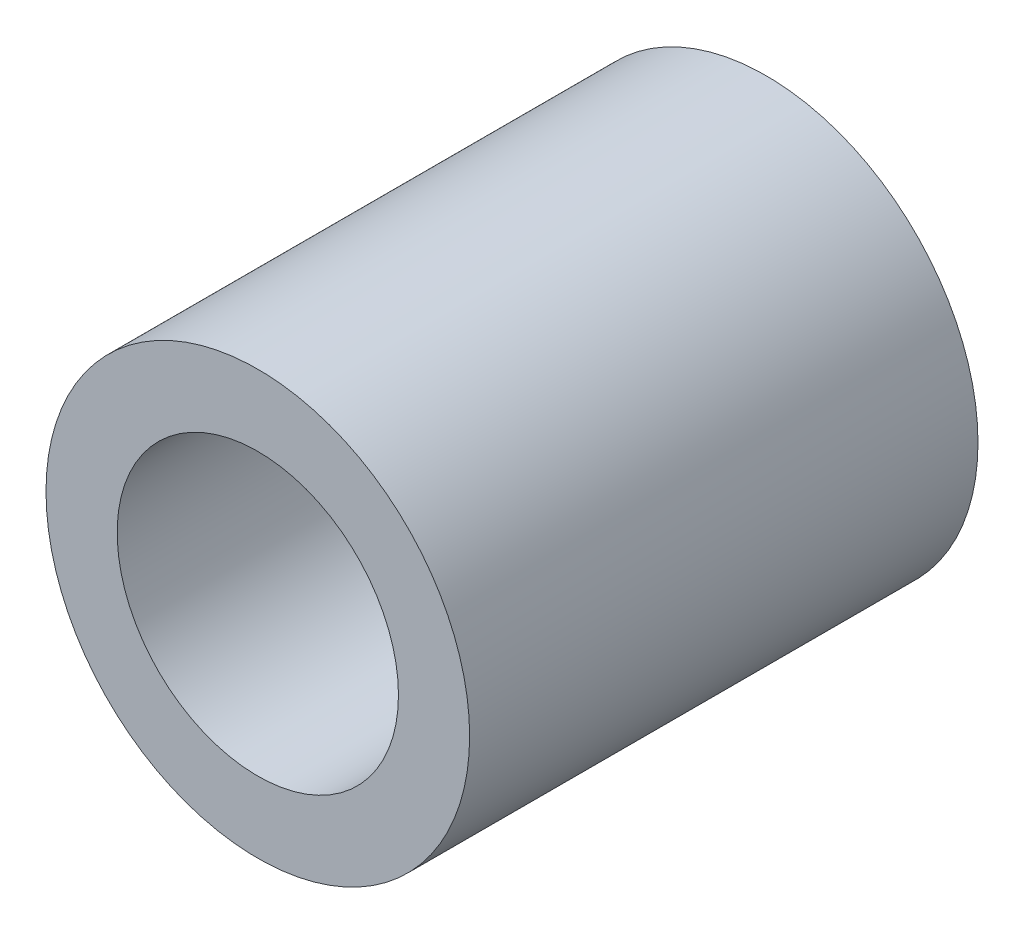
from build123d import *

# Parameters (mm, degrees)
SKETCH1_W = 7.62
SKETCH1_H = 1.0668


with BuildPart() as part:
    # Sketch1 → Revolve1 (revolve)
    with BuildSketch(Plane(origin=(0, 0, 0), x_dir=(0, 0, -1), z_dir=(1, 0, 0)), mode=Mode.PRIVATE) as revolve1_sk:
        with Locations((0, 2.6416)):
            Rectangle(SKETCH1_W, SKETCH1_H)
    revolve(revolve1_sk.sketch.rotate(Axis((0, 0, 43.465184419), (0, 0, -1)), 90), axis=Axis((0, 0, 43.465184419), (0, 0, -1)))


solid = part.part
